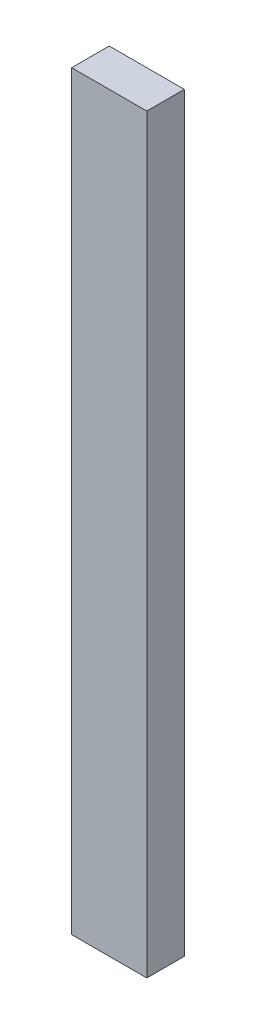
from build123d import *

# Parameters (mm, degrees)
SKETCH1_W           = 100
SKETCH1_H           = 50
BOSS_EXTRUDE1_DEPTH = 1000


with BuildPart() as part:
    # Sketch1 → Boss-Extrude1 (new body)
    with BuildSketch(Plane(origin=(0, 0, 0), x_dir=(1, 0, 0), z_dir=(0, 1, 0))):
        with Locations((-50, 25)):
            Rectangle(SKETCH1_W, SKETCH1_H)
    extrude(amount=BOSS_EXTRUDE1_DEPTH)


solid = part.part
